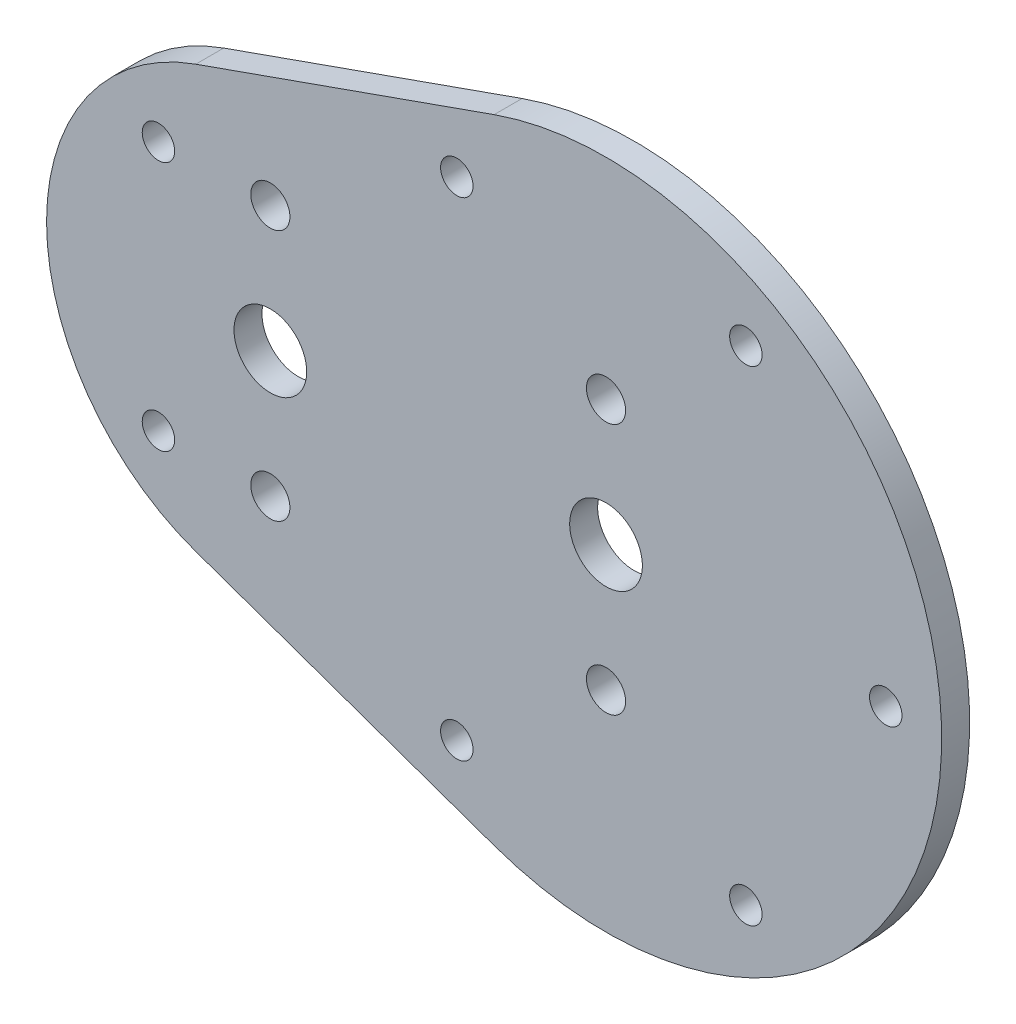
from build123d import *

# Parameters (mm, degrees)
BOSS_EXTRU_1_DEPTH           = 5
ENL_V_MAT_EXTRU_1_DEPTH      = 131.1355063
ENL_V_MAT_EXTRU_1_DEPTH_BACK = 140
ESQUISSE2_R                  = 3.5
D_GAGEMENT_M51_D             = 5.8
D_GAGEMENT_M51_DEPTH         = 90
D_GAGEMENT_M51_TIP           = 1.742495795
ENL_V_MAT_EXTRU_3_DEPTH      = 167.883192683
ENL_V_MAT_EXTRU_3_DEPTH_BACK = 167.883192683
ESQUISSE6_R                  = 6.5
ENL_V_START                  = -0.5
ESQUISSE7_W                  = 75
ESQUISSE7_H                  = 4
ENL_V_MAT_EXTRU_4_DEPTH      = 0.5


with BuildPart() as part:
    # Esquisse1 → Boss.-Extru.1 (new body)
    with BuildSketch(Plane.XY):
        with BuildLine():
            Line((-20, 56.568542495), (-73.333333333, 37.712361663))
            ThreePointArc((-73.333333333, 37.712361663), (-100, 0), (-73.333333333, -37.712361663))
            Line((-73.333333333, -37.712361663), (-20, -56.568542495))
            ThreePointArc((-20, -56.568542495), (34.641016151, -48.989794856), (60, 0))
            ThreePointArc((60, 0), (34.641016151, 48.989794856), (-20, 56.568542495))
        make_face()
    extrude(amount=BOSS_EXTRU_1_DEPTH)

    # Esquisse2 → Enlèv. mat.-Extru.1 (cut, two sides: drawn at the far end of the back side and taken through both)
    with BuildSketch(Plane(origin=(15, 0, -5.5), x_dir=(0, -1, 0), z_dir=(0, 0, -1)).offset(-ENL_V_MAT_EXTRU_1_DEPTH_BACK)):
        with Locations(Location((-22.5, 15, 0), (0, 0, 90))):
            Circle(ESQUISSE2_R)
        with Locations(Location((22.5, 15, 0), (0, 0, 90))):
            Circle(ESQUISSE2_R)
        with Locations(Location((22.5, 75, 0), (0, 0, 90))):
            Circle(ESQUISSE2_R)
        with Locations(Location((-22.5, 75, 0), (0, 0, 90))):
            Circle(ESQUISSE2_R)
    extrude(amount=ENL_V_MAT_EXTRU_1_DEPTH + ENL_V_MAT_EXTRU_1_DEPTH_BACK, mode=Mode.SUBTRACT)

    # Dégagement M51
    with Locations(Plane(origin=(15, 0, 48), x_dir=(0, 1, 0), z_dir=(0, 0, 1))):
        with Locations((43.604918173, 41.666666667), (0, -35), (-43.301270189, -10), (43.301270189, -10), (-22.360679775, 95), (22.360679775, 95), (-43.604918173, 41.666666667)):
            Hole(D_GAGEMENT_M51_D / 2, depth=D_GAGEMENT_M51_DEPTH)
            with Locations((0, 0, -(D_GAGEMENT_M51_DEPTH + D_GAGEMENT_M51_TIP / 2))):  # 118° drill point
                Cone(0, D_GAGEMENT_M51_D / 2, D_GAGEMENT_M51_TIP, mode=Mode.SUBTRACT)

    # Esquisse6 → Enlèv. mat.-Extru.3 (cut, two sides: drawn at the far end of the back side and taken through both)
    with BuildSketch(Plane(origin=(15, 0, -100), x_dir=(0, -1, 0), z_dir=(0, 0, -1)).offset(-ENL_V_MAT_EXTRU_3_DEPTH_BACK)):
        with Locations(Location((0, 15, 0), (0, 0, 180))):
            Circle(ESQUISSE6_R)
        with Locations(Location((0, 75, 0), (0, 0, 180))):
            Circle(ESQUISSE6_R)
    extrude(amount=ENL_V_MAT_EXTRU_3_DEPTH + ENL_V_MAT_EXTRU_3_DEPTH_BACK, mode=Mode.SUBTRACT)

    # Esquisse7 → Enlèv. mat.-Extru.4 (cut)
    with BuildSketch(Plane(origin=(15, 0, 0), x_dir=(0, -1, 0), z_dir=(0, 0, -1)).offset(ENL_V_START)):
        with Locations((0, -22.686269666)):
            Rectangle(ESQUISSE7_W, ESQUISSE7_H)
    extrude(amount=ENL_V_MAT_EXTRU_4_DEPTH, mode=Mode.SUBTRACT)


solid = part.part
